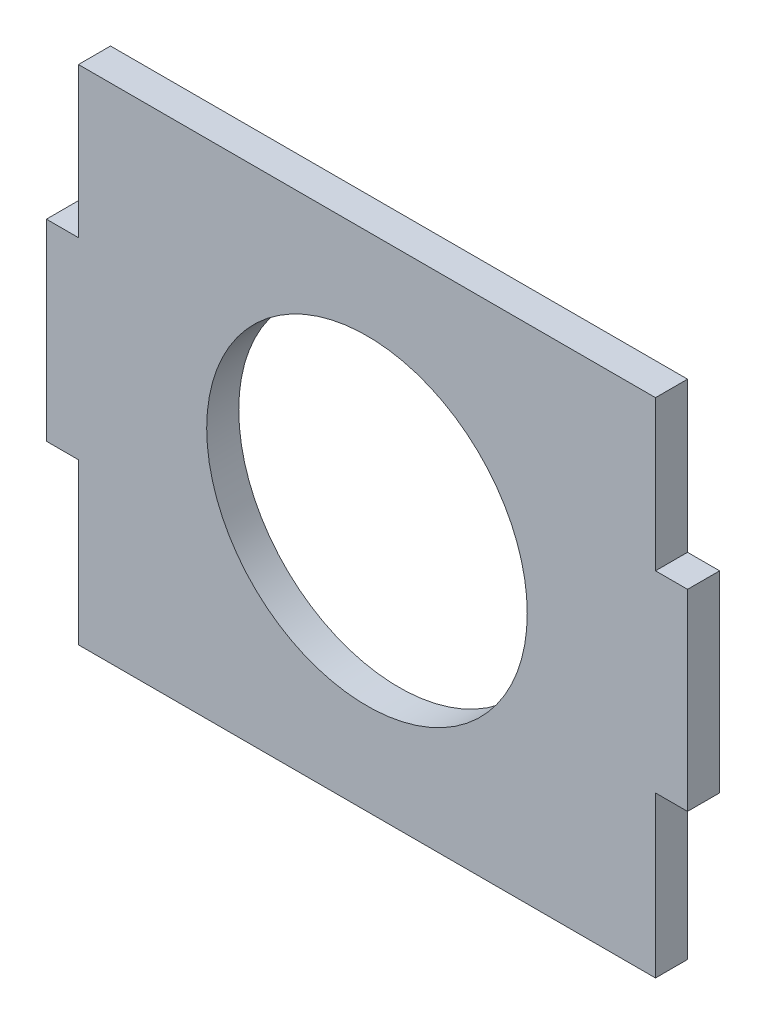
from build123d import *

# Parameters (mm, degrees)
SKETCH1_R           = 15.875
BOSS_EXTRUDE1_DEPTH = 3.175


with BuildPart() as part:
    # Sketch1 → Boss-Extrude1 (new body)
    with BuildSketch(Plane.XY):
        Polygon((-3.175, 56.126459878), (-60.325, 56.126459878), (-60.325, 41.275), (-63.5, 41.275), (-63.5, 22.225), (-60.325, 22.225), (-60.325, 6.35), (-3.175, 6.35), (-3.175, 22.225), (0, 22.225), (0, 41.275), (-3.175, 41.275), align=None)
        with Locations((-31.75, 31.27375)):
            Circle(SKETCH1_R, mode=Mode.SUBTRACT)
    extrude(amount=BOSS_EXTRUDE1_DEPTH)


solid = part.part
